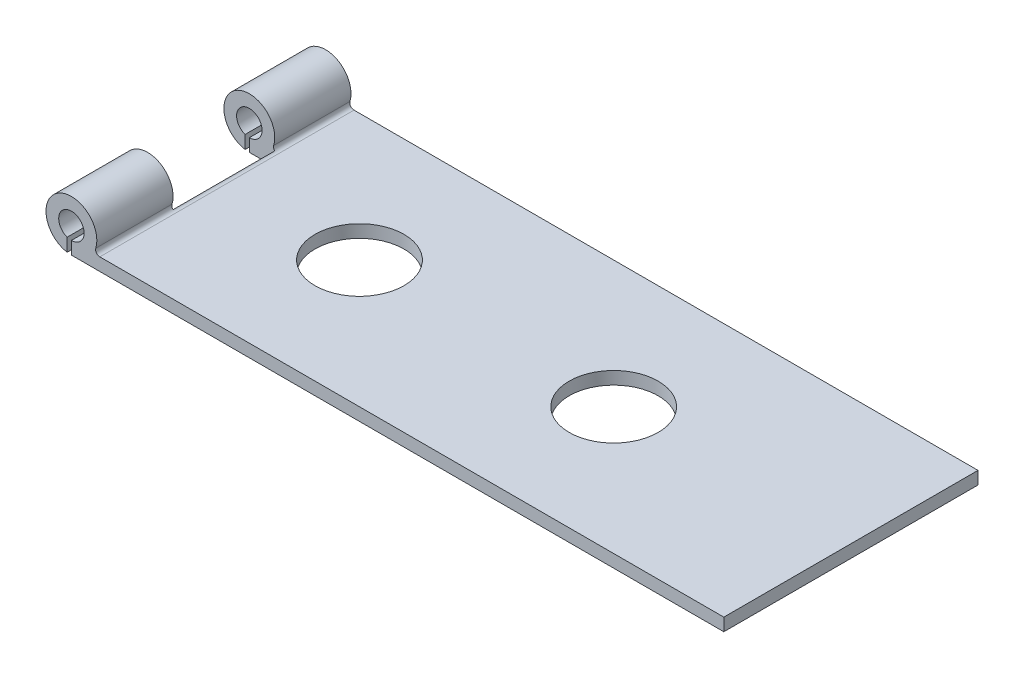
from build123d import *

# Parameters (mm, degrees)
SKETCH_1_R               = 1.5
EXTRUDE_1_DEPTH          = 15
CUT_EXTRUDE_2_DEPTH      = 79.576395947
CUT_EXTRUDE_2_DEPTH_BACK = 79.576395947
SKETCH_2_W               = 6
SKETCH_2_H               = 12
CUT_EXTRUDE_3_DEPTH      = 83.692200358
CUT_EXTRUDE_3_DEPTH_BACK = 83.692200358
SKETCH_3_W               = 0.5
SKETCH_3_H               = 10
CUT_EXTRUDE_4_DEPTH      = 79.576395947
CUT_EXTRUDE_4_DEPTH_BACK = 79.576395947
SKETCH_4_R               = 5.25


with BuildPart() as part:
    # 草图1 → 凸台-拉伸1 (new, symmetric)
    with BuildSketch(Plane.XY):
        with BuildLine():
            Line((0, -3), (77, -3))
            Line((77, -3), (77, -1.5))
            Line((77, -1.5), (3.354101966, -1.5))
            ThreePointArc((3.354101966, -1.5), (2.953210103, -1.298807152), (2.874944542, -0.857142857))
            ThreePointArc((2.874944542, -0.857142857), (-1.792842914, 2.405351177), (0, -3))
        make_face()
        Circle(SKETCH_1_R, mode=Mode.SUBTRACT)
    extrude(amount=EXTRUDE_1_DEPTH, both=True)

    # 草图2 → 切除-拉伸2 (cut, two sides: drawn at the far end of the back side and taken through both)
    with BuildSketch(Plane(origin=(0, -1.5, 0), x_dir=(1, 0, 0), z_dir=(0, 1, 0)).offset(-CUT_EXTRUDE_2_DEPTH_BACK)):
        Rectangle(SKETCH_2_W, SKETCH_2_H)
    extrude(amount=CUT_EXTRUDE_2_DEPTH + CUT_EXTRUDE_2_DEPTH_BACK, mode=Mode.SUBTRACT)

    # 草图3 → 切除-拉伸3 (cut, two sides: drawn at the far end of the back side and taken through both)
    with BuildSketch(Plane.XY.offset(15).offset(-CUT_EXTRUDE_3_DEPTH_BACK)):
        with Locations((-0.25, -5)):
            Rectangle(SKETCH_3_W, SKETCH_3_H)
    extrude(amount=CUT_EXTRUDE_3_DEPTH + CUT_EXTRUDE_3_DEPTH_BACK, mode=Mode.SUBTRACT)

    # 草图4 → 切除-拉伸4 (cut, two sides: drawn at the far end of the back side and taken through both)
    with BuildSketch(Plane(origin=(0, -1.5, 0), x_dir=(1, 0, 0), z_dir=(0, 1, 0)).offset(-CUT_EXTRUDE_4_DEPTH_BACK)):
        with Locations(Location((19, 0, 0), (0, 0, 270))):
            Circle(SKETCH_4_R)
        with Locations(Location((49, 0, 0), (0, 0, 270))):
            Circle(SKETCH_4_R)
    extrude(amount=CUT_EXTRUDE_4_DEPTH + CUT_EXTRUDE_4_DEPTH_BACK, mode=Mode.SUBTRACT)


solid = part.part
